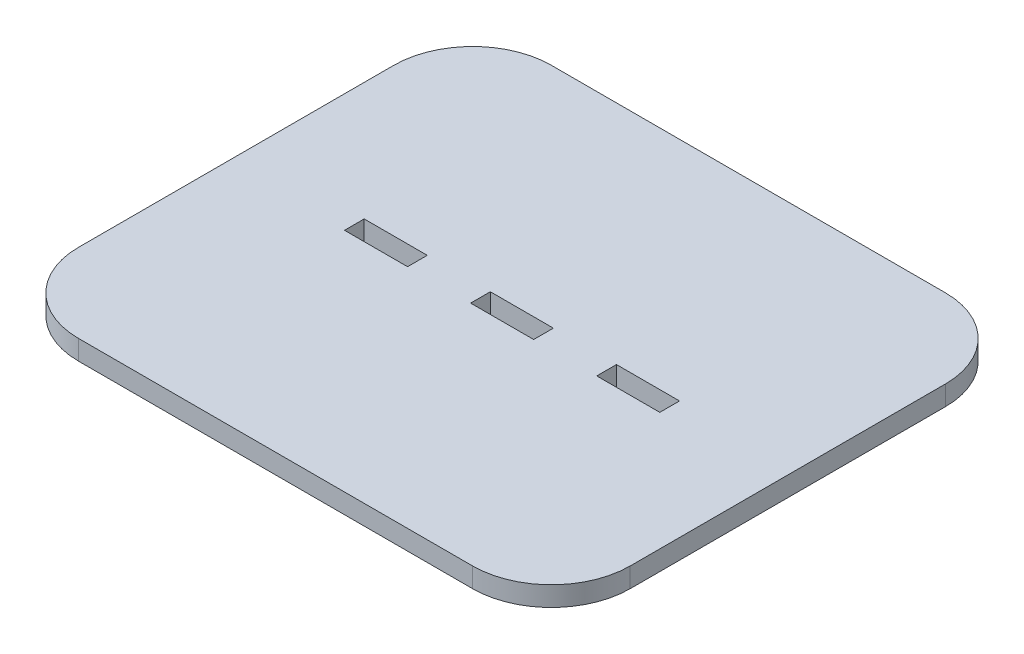
from build123d import *

# Parameters (mm, degrees)
SKETCH1_W           = 16
SKETCH1_H           = 5
BOSS_EXTRUDE1_DEPTH = 5


with BuildPart() as part:
    # Sketch1 → Boss-Extrude1 (new body)
    with BuildSketch(Plane(origin=(0, 0, 0), x_dir=(1, 0, 0), z_dir=(0, 1, 0))):
        with BuildLine():
            Line((-50, 60), (50, 60))
            ThreePointArc((50, 60), (64.142135624, 54.142135624), (70, 40))
            Line((70, 40), (70, -40))
            ThreePointArc((70, -40), (64.142135624, -54.142135624), (50, -60))
            Line((50, -60), (-50, -60))
            ThreePointArc((-50, -60), (-64.142135624, -54.142135624), (-70, -40))
            Line((-70, -40), (-70, 40))
            ThreePointArc((-70, 40), (-64.142135624, 54.142135624), (-50, 60))
        make_face()
        Rectangle(SKETCH1_W, SKETCH1_H, mode=Mode.SUBTRACT)
        with Locations((-32, 0)):
            Rectangle(SKETCH1_W, SKETCH1_H, mode=Mode.SUBTRACT)
        with Locations((32, 0)):
            Rectangle(SKETCH1_W, SKETCH1_H, mode=Mode.SUBTRACT)
    extrude(amount=BOSS_EXTRUDE1_DEPTH)


solid = part.part
